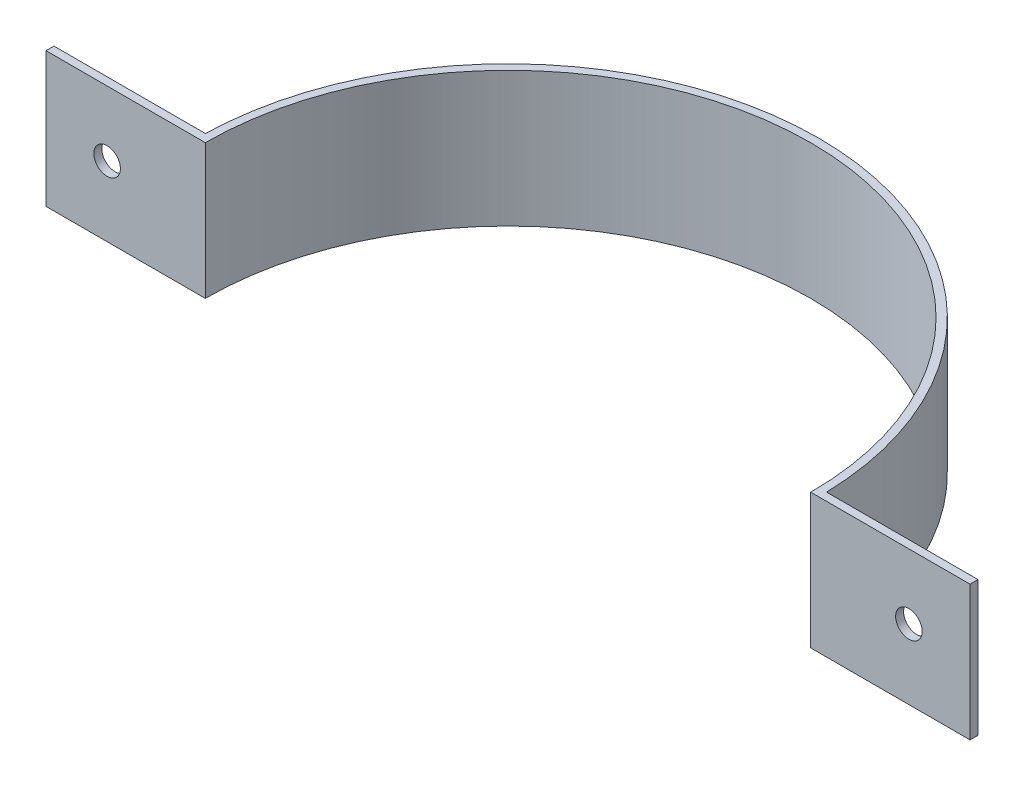
from build123d import *

# Parameters (mm, degrees)
SALIENTE_EXTRUIR1_DEPTH = 25.4
CROQUIS2_W              = 30
CROQUIS2_H              = 25.4
SALIENTE_EXTRUIR2_DEPTH = 1.5
CROQUIS4_R              = 2.5
CORTAR_EXTRUIR1_DEPTH   = 10


with BuildPart() as part:
    # Croquis1 → Saliente-Extruir1 (new body)
    with BuildSketch(Plane(origin=(0, 0, 0), x_dir=(1, 0, 0), z_dir=(0, 1, 0))):
        with BuildLine():
            Line((-58.5, 0), (-57, 0))
            ThreePointArc((-57, 0), (0, 57), (57, 0))
            Line((57, 0), (58.5, 0))
            ThreePointArc((58.5, 0), (0, 58.5), (-58.5, 0))
        make_face()
    extrude(amount=SALIENTE_EXTRUIR1_DEPTH)

    # Croquis2 → Saliente-Extruir2 (add)
    with BuildSketch(Plane.XY):
        with Locations((72, 12.7)):
            Rectangle(CROQUIS2_W, CROQUIS2_H)
        with Locations((-72, 12.7)):
            Rectangle(CROQUIS2_W, CROQUIS2_H)
    extrude(amount=-SALIENTE_EXTRUIR2_DEPTH)

    # Croquis4 → Cortar-Extruir1 (cut)
    with BuildSketch(Plane(origin=(0, 0, -1.5), x_dir=(-1, 0, 0), z_dir=(0, 0, -1))):
        with Locations((75.49, 13.164314045)):
            Circle(CROQUIS4_R)
        with Locations((-75.49, 13.164314045)):
            Circle(CROQUIS4_R)
    extrude(amount=-CORTAR_EXTRUIR1_DEPTH, mode=Mode.SUBTRACT)


solid = part.part
